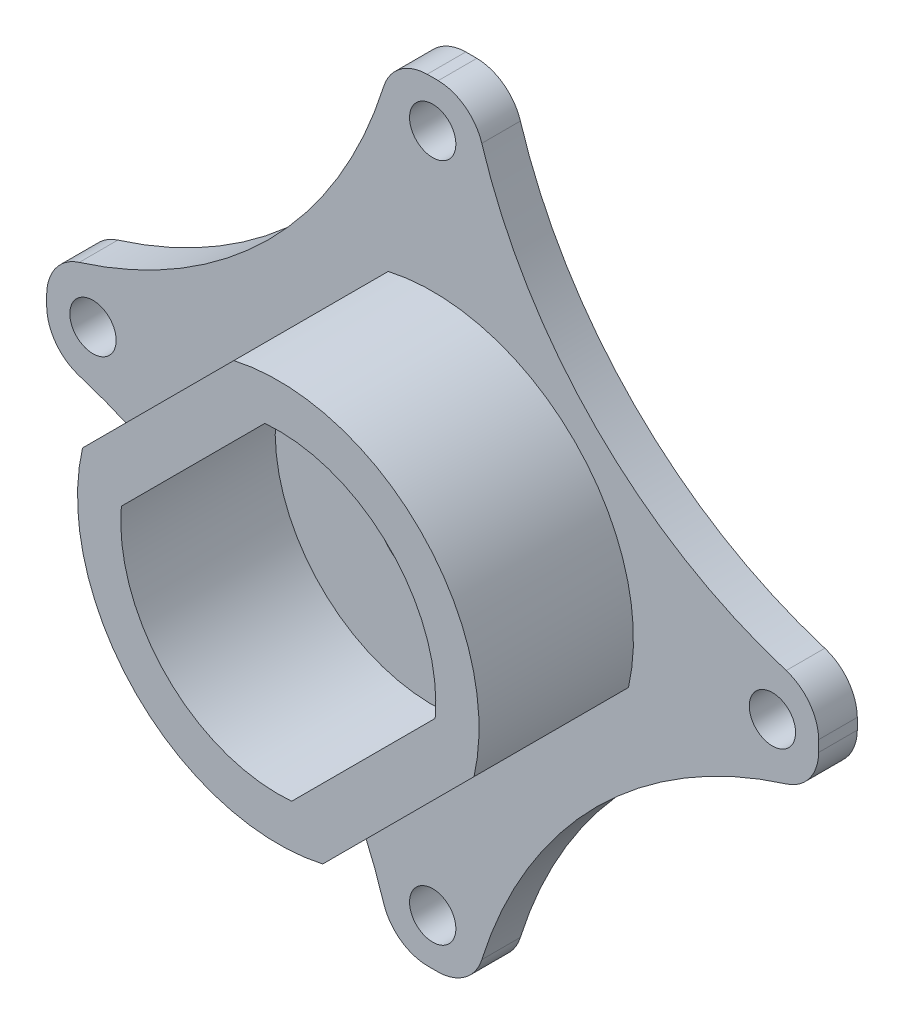
from build123d import *

# Parameters (mm, degrees)
SKETCH_1_R               = 25
SKETCH_1_R_2             = 1.5
EXTRUDE_1_DEPTH          = 2.5
CUT_EXTRUDE_2_DEPTH      = 36.443617197
CUT_EXTRUDE_2_DEPTH_BACK = 36.443617197
SKETCH_3_R               = 4
CUT_EXTRUDE_5_DEPTH      = 10
FILLET_2_R               = 3
EXTRUDE_2_DEPTH          = 10


with BuildPart() as part:
    # 草图1 → 凸台-拉伸1 (new body)
    with BuildSketch(Plane.XY):
        Circle(SKETCH_1_R)
        with Locations((0, 22)):
            Circle(SKETCH_1_R_2, mode=Mode.SUBTRACT)
        with Locations((22, 0)):
            Circle(SKETCH_1_R_2, mode=Mode.SUBTRACT)
        with Locations((0, -22)):
            Circle(SKETCH_1_R_2, mode=Mode.SUBTRACT)
        with Locations(Location((-22, 0, 0), (0, 0, 180))):
            Circle(SKETCH_1_R_2, mode=Mode.SUBTRACT)
    extrude(amount=EXTRUDE_1_DEPTH)

    # 草图3 → 切除-拉伸2 (cut, two sides: drawn at the far end of the back side and taken through both)
    with BuildSketch(Plane(origin=(0, 0, 0), x_dir=(-1, 0, 0), z_dir=(0, 0, -1)).offset(-CUT_EXTRUDE_2_DEPTH_BACK)):
        Circle(SKETCH_3_R)
    extrude(amount=CUT_EXTRUDE_2_DEPTH + CUT_EXTRUDE_2_DEPTH_BACK, mode=Mode.SUBTRACT)

    # 草图5 → 切除-拉伸5 (cut)
    with BuildSketch(Plane(origin=(0, 0, 0), x_dir=(-1, 0, 0), z_dir=(0, 0, -1))):
        with BuildLine():
            ThreePointArc((-2.638187412, 24.860409634), (-17.67766953, 17.67766953), (-24.860409634, 2.638187412))
            ThreePointArc((-24.860409634, 2.638187412), (-10.606601718, 10.606601718), (-2.638187412, 24.860409634))
        make_face()
        with BuildLine():
            ThreePointArc((-2.638187412, -24.860409634), (-10.606601718, -10.606601718), (-24.860409634, -2.638187412))
            ThreePointArc((-24.860409634, -2.638187412), (-17.67766953, -17.67766953), (-2.638187412, -24.860409634))
        make_face()
        with BuildLine():
            ThreePointArc((24.860409634, -2.638187412), (10.606601718, -10.606601718), (2.638187412, -24.860409634))
            ThreePointArc((2.638187412, -24.860409634), (17.67766953, -17.67766953), (24.860409634, -2.638187412))
        make_face()
        with BuildLine():
            ThreePointArc((24.860409634, 2.638187412), (17.67766953, 17.67766953), (2.638187412, 24.860409634))
            ThreePointArc((2.638187412, 24.860409634), (10.606601718, 10.606601718), (24.860409634, 2.638187412))
        make_face()
    extrude(amount=-CUT_EXTRUDE_5_DEPTH, mode=Mode.SUBTRACT)

    # 圆角2
    fillet_2_edges = [part.edges().sort_by_distance(p)[0] for p in [
        (2.638187412, 24.860409634, 1.25),
        (24.860409634, 2.638187412, 1.25),
        (24.860409634, -2.638187412, 1.25),
        (2.638187412, -24.860409634, 1.25),
        (-2.638187412, -24.860409634, 1.25),
        (-24.860409634, -2.638187412, 1.25),
        (-24.860409634, 2.638187412, 1.25),
        (-2.638187412, 24.860409634, 1.25),
    ]]
    fillet(fillet_2_edges, radius=FILLET_2_R)

    # 草图6 → 凸台-拉伸2 (add)
    with BuildSketch(Plane.XY.offset(2.5)):
        with BuildLine():
            Line((-12.677154079, 2.879195107), (-2.879195107, 12.677154079))
            ThreePointArc((-2.879195107, 12.677154079), (9.192388155, 9.192388155), (12.677154079, -2.879195107))
            Line((12.677154079, -2.879195107), (2.879195107, -12.677154079))
            ThreePointArc((2.879195107, -12.677154079), (-9.192388155, -9.192388155), (-12.677154079, 2.879195107))
        make_face()
        with BuildLine():
            Line((-10.163012909, 0.867852878), (-0.867852878, 10.163012909))
            ThreePointArc((-0.867852878, 10.163012909), (7.212489168, 7.212489168), (10.163012909, -0.867852878))
            Line((10.163012909, -0.867852878), (0.867852878, -10.163012909))
            ThreePointArc((0.867852878, -10.163012909), (-7.212489168, -7.212489168), (-10.163012909, 0.867852878))
        make_face(mode=Mode.SUBTRACT)
    extrude(amount=EXTRUDE_2_DEPTH)


solid = part.part
